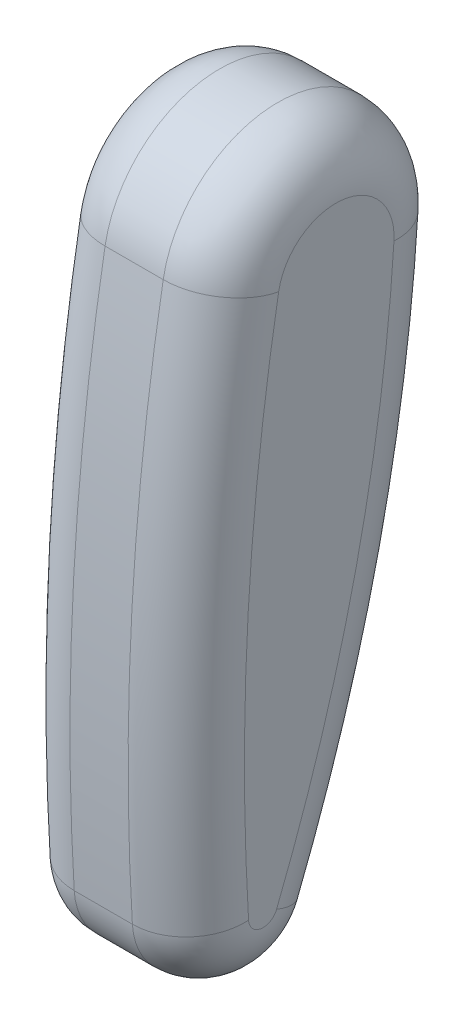
from build123d import *

# Parameters (mm, degrees)
BASE_EXTRUDE_DEPTH = 76.2
FILLET1_R          = 50.8


with BuildPart() as part:
    # Sketch6 → Base-Extrude (new, symmetric)
    with BuildSketch(Plane(origin=(114.3, 0, 0), x_dir=(0, 0, -1), z_dir=(1, 0, 0))):
        with BuildLine():
            ThreePointArc((140.863322284, -309.38746157), (51.487534639, -202.075387677), (-60.600919328, -285.382596895))
            ThreePointArc((-60.600919328, -285.382596895), (-87.974645435, -521.672761045), (-87.547578328, -759.542851996))
            ThreePointArc((-87.547578328, -759.542851996), (-34.291316824, -818.399413874), (34.789931143, -779.308424571))
            ThreePointArc((34.789931143, -779.308424571), (106.512103035, -548.56574137), (140.863322284, -309.38746157))
        make_face()
    extrude(amount=BASE_EXTRUDE_DEPTH, both=True)

    # Fillet1
    fillet1_edges = [part.edges().sort_by_distance(p)[0] for p in [
        (38.1, -818.399413874, 34.291316824),
        (190.5, -818.399413874, 34.291316824),
        (38.1, -521.672761045, 87.974645435),
        (190.5, -521.672761045, 87.974645435),
        (38.1, -202.075387677, -51.487534639),
        (190.5, -202.075387677, -51.487534639),
        (190.5, -548.56574137, -106.512103035),
        (38.1, -548.56574137, -106.512103035),
    ]]
    fillet(fillet1_edges, radius=FILLET1_R)


solid = part.part
